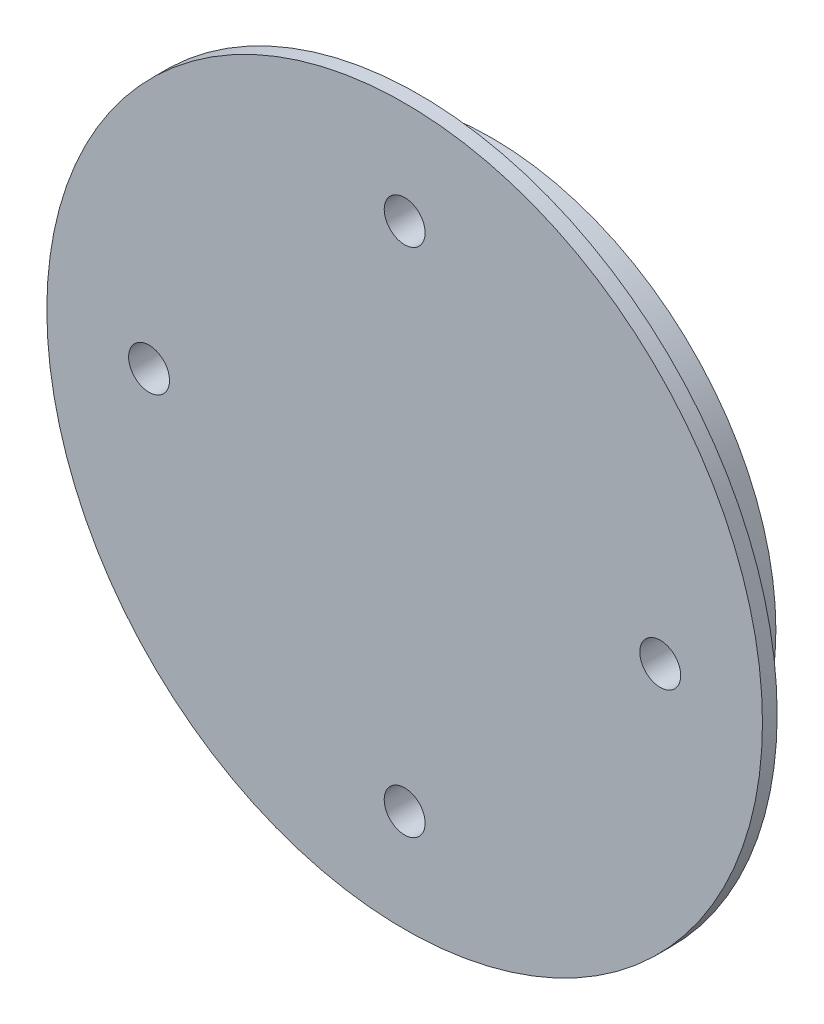
from build123d import *

# Parameters (mm, degrees)
SKETCH_1_R          = 23.5
EXTRUDE_1_DEPTH     = 2.5
SKETCH_2_R          = 22.225
EXTRUDE_2_DEPTH     = 3.175
SKETCH_3_R          = 1.6
CUT_EXTRUDE_1_DEPTH = 34.715065253
SKETCH_4_R          = 28
SKETCH_4_R_2        = 1.6
EXTRUDE_3_DEPTH     = 1.15


with BuildPart() as part:
    # ｽｹｯﾁ1 → ﾎﾞｽ - 押し出し1 (new body)
    with BuildSketch(Plane.XY):
        Circle(SKETCH_1_R)
    extrude(amount=EXTRUDE_1_DEPTH)

    # ｽｹｯﾁ2 → ﾎﾞｽ - 押し出し2 (add)
    with BuildSketch(Plane(origin=(0, 0, 0), x_dir=(-1, 0, 0), z_dir=(0, 0, -1))):
        Circle(SKETCH_2_R)
    extrude(amount=EXTRUDE_2_DEPTH)

    # ｽｹｯﾁ3 → ｶｯﾄ - 押し出し1 (cut, through all)
    with BuildSketch(Plane(origin=(0, 0, -3.175), x_dir=(-1, 0, 0), z_dir=(0, 0, -1))):
        with Locations((0, 20)):
            Circle(SKETCH_3_R)
        with Locations((20, 0)):
            Circle(SKETCH_3_R)
        with Locations((0, -20)):
            Circle(SKETCH_3_R)
        with Locations((-20, 0)):
            Circle(SKETCH_3_R)
    extrude(amount=-CUT_EXTRUDE_1_DEPTH, mode=Mode.SUBTRACT)

    # ｽｹｯﾁ4 → ﾎﾞｽ - 押し出し3 (add)
    with BuildSketch(Plane.XY.offset(2.5)):
        Circle(SKETCH_4_R)
        with Locations(Location((0, 20, 0), (0, 0, 180))):
            Circle(SKETCH_4_R_2, mode=Mode.SUBTRACT)
        with Locations(Location((-20, 0, 0), (0, 0, 180))):
            Circle(SKETCH_4_R_2, mode=Mode.SUBTRACT)
        with Locations(Location((0, -20, 0), (0, 0, 180))):
            Circle(SKETCH_4_R_2, mode=Mode.SUBTRACT)
        with Locations(Location((20, 0, 0), (0, 0, 180))):
            Circle(SKETCH_4_R_2, mode=Mode.SUBTRACT)
    extrude(amount=EXTRUDE_3_DEPTH)


solid = part.part
